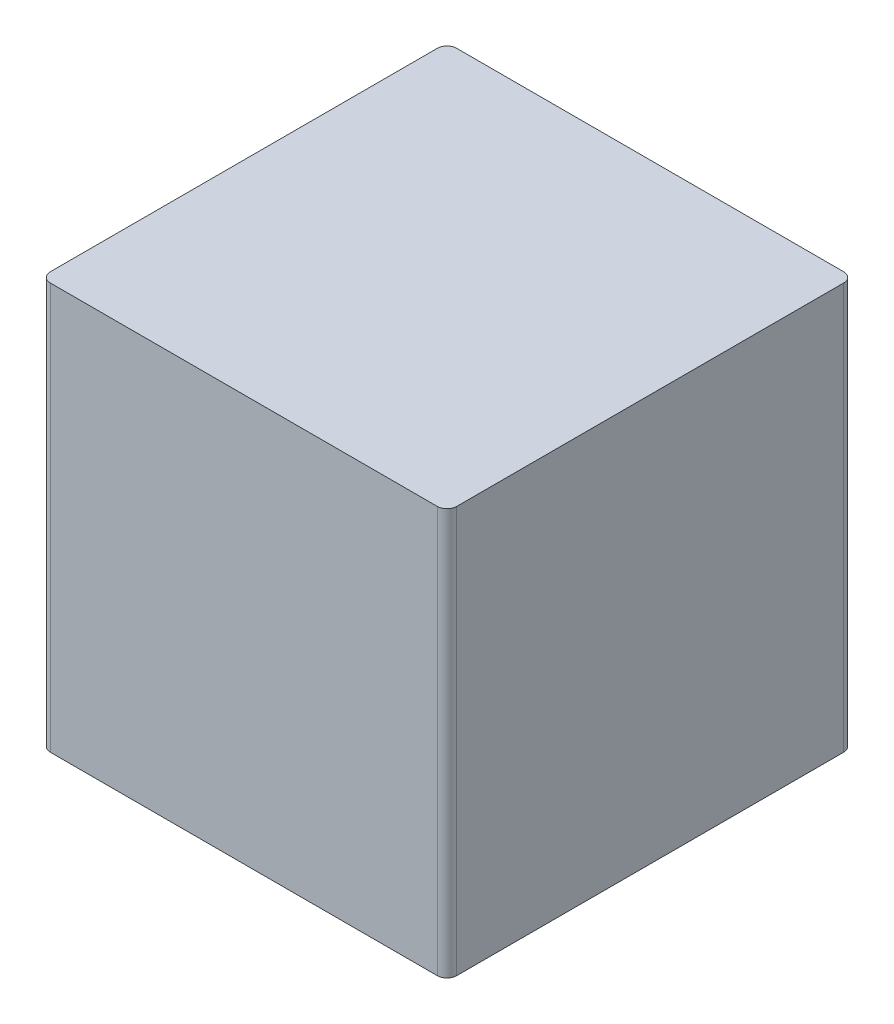
from build123d import *

# Parameters (mm, degrees)
SKIZZE1_W                       = 42
SKIZZE1_H                       = 42
AUFSATZ_LINEAR_AUSTRAGEN1_DEPTH = 42
VERRUNDUNG1_R                   = 1
SKIZZE2_W                       = 40.5
SKIZZE2_H                       = 40.5
SCHNITT_LINEAR_AUSTRAGEN1_DEPTH = 1


with BuildPart() as part:
    # Skizze1 → Aufsatz-Linear austragen1 (new body)
    with BuildSketch(Plane(origin=(0, 0, 0), x_dir=(1, 0, 0), z_dir=(0, 1, 0))):
        with Locations((21, 21)):
            Rectangle(SKIZZE1_W, SKIZZE1_H)
    extrude(amount=AUFSATZ_LINEAR_AUSTRAGEN1_DEPTH)

    # Verrundung1
    verrundung1_edges = [part.edges().sort_by_distance(p)[0] for p in [
        (42, 21, 0),
        (0, 21, 0),
        (0, 21, -42),
        (42, 21, -42),
    ]]
    fillet(verrundung1_edges, radius=VERRUNDUNG1_R)

    # Skizze2 → Schnitt-Linear austragen1 (cut)
    with BuildSketch(Plane(origin=(0, 0, 0), x_dir=(1, 0, 0), z_dir=(0, 1, 0))):
        with Locations((21, 21)):
            Rectangle(SKIZZE2_W, SKIZZE2_H)
    extrude(amount=SCHNITT_LINEAR_AUSTRAGEN1_DEPTH, mode=Mode.SUBTRACT)


solid = part.part
